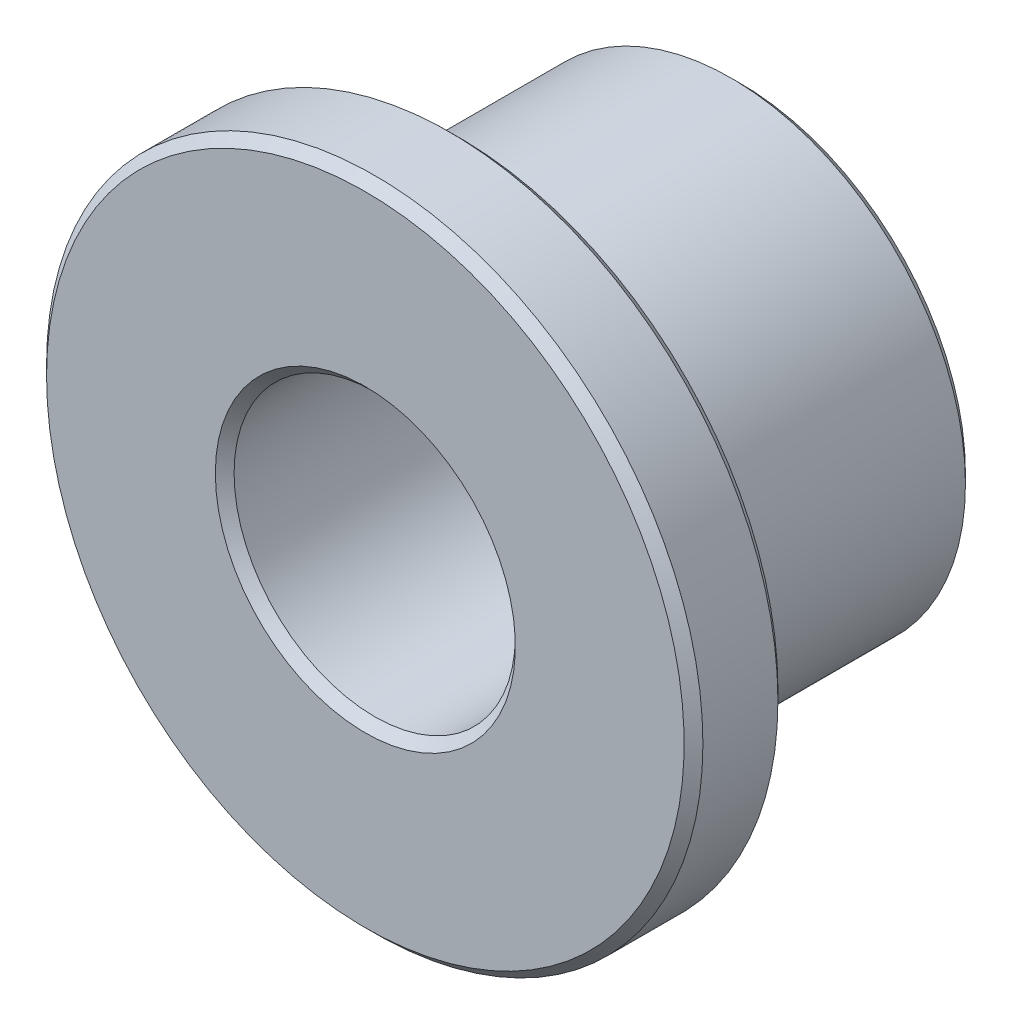
from build123d import *

# Parameters (mm, degrees)
CHAMFER1_SIZE = 0.2


with BuildPart() as part:
    # Sketch1 → Revolve1 (revolve)
    with BuildSketch(Plane(origin=(0, 0, 0), x_dir=(0, 0, -1), z_dir=(1, 0, 0)), mode=Mode.PRIVATE) as revolve1_sk:
        Polygon((0, 3), (0, 7), (2, 7), (2, 5), (8, 5), (8, 3), align=None)
    revolve(revolve1_sk.sketch.rotate(Axis((0, 0, 0), (0, 0, -1)), 90), axis=Axis((0, 0, 0), (0, 0, -1)))

    # Chamfer1
    chamfer1_edges = [part.edges().sort_by_distance(p)[0] for p in [
        (-3, 0, -8),
        (-5, 0, -8),
        (-5, 0, -2),
        (-7, 0, -2),
        (-7, 0, 0),
        (-3, 0, 0),
    ]]
    chamfer(chamfer1_edges, length=CHAMFER1_SIZE)


solid = part.part
